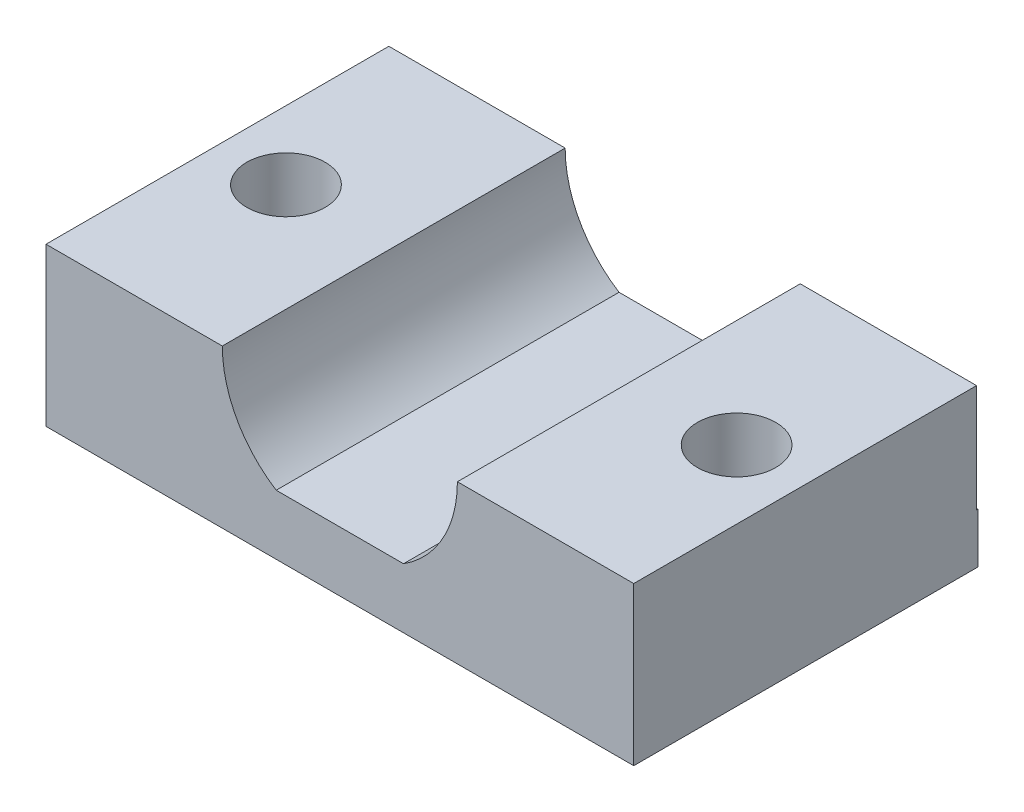
from build123d import *

# Parameters (mm, degrees)
SKETCH_2_W               = 50
SKETCH_2_H               = 4
EXTRUDE_2_DEPTH          = 22.5
SKETCH_15_R              = 1.4
EXTRUDE_8_DEPTH          = 5
SKETCH_3_W               = 30
SKETCH_3_H               = 20
EXTRUDE_4_DEPTH          = 20
EXTRUDE_9_DEPTH          = 17.5
EXTRUDE_10_DEPTH         = 15
CUT_EXTRUDE_1_REACH      = 58.089
SKETCH_19_R              = 2.1
SKETCH_20_R              = 2
CUT_EXTRUDE_2_DEPTH      = 10
CUT_EXTRUDE_3_DEPTH      = 70.524879929
CUT_EXTRUDE_3_DEPTH_BACK = 70.524879929


with BuildPart() as part:
    # 草圖2 → 填料-伸長2 (new, symmetric)
    with BuildSketch(Plane(origin=(0, 0, 0), x_dir=(0, 0, -1), z_dir=(1, 0, 0))):
        with Locations((25, 2)):
            Rectangle(SKETCH_2_W, SKETCH_2_H)
    extrude(amount=EXTRUDE_2_DEPTH, both=True)

    # 草圖15 → 填料-伸長8 (add)
    with BuildSketch(Plane(origin=(0, 4, 0), x_dir=(1, 0, 0), z_dir=(0, 1, 0))):
        with Locations(Location((17.5, 39.2, 0), (0, 0, 90))):
            Circle(SKETCH_15_R)
        with Locations(Location((17.5, 24.2, 0), (0, 0, 90))):
            Circle(SKETCH_15_R)
    extrude(amount=EXTRUDE_8_DEPTH)

    # 草圖3 → 填料-伸長4 (add)
    with BuildSketch(Plane(origin=(0, 4, 0), x_dir=(1, 0, 0), z_dir=(0, 1, 0))):
        with Locations((0, 10)):
            Rectangle(SKETCH_3_W, SKETCH_3_H)
    extrude(amount=EXTRUDE_4_DEPTH)

    # 草圖16 → 填料-伸長9 (add)
    with BuildSketch(Plane(origin=(0, 0, 0), x_dir=(-1, 0, 0), z_dir=(0, 0, -1))):
        with BuildLine():
            Line((-15, 24), (-15, 36.000002525))
            Line((-15, 36.000002525), (-6, 36.000002525))
            ThreePointArc((-6, 36.000002525), (-5.267141914, 33.146824473), (-3.25, 31.000002525))
            Line((-3.25, 31.000002525), (3.25, 31.000002525))
            ThreePointArc((3.25, 31.000002525), (5.267141914, 33.146824473), (6, 36.000002525))
            Line((6, 36.000002525), (15, 36.000002525))
            Line((15, 36.000002525), (15, 24))
            Line((15, 24), (-15, 24))
        make_face()
    extrude(amount=EXTRUDE_9_DEPTH)

    # 草圖18 → 填料-伸長10 (add, symmetric)
    with BuildSketch(Plane(origin=(0, 0, 0), x_dir=(0, 0, -1), z_dir=(1, 0, 0))):
        Polygon((17.5, 24), (28.5, 24), (28.5, 42.748788628), (27, 42.748788628), (27, 30.5), (17.5, 30.5), align=None)
    extrude(amount=EXTRUDE_10_DEPTH, both=True)

    # 草圖19 → 除料-伸長1 (cut, up to next)
    with BuildSketch(Plane(origin=(0, 0, -28.5), x_dir=(-1, 0, 0), z_dir=(0, 0, -1)), mode=Mode.PRIVATE) as cut_extrude_1_sk1:
        with Locations((0, 36.000002505)):
            Circle(SKETCH_19_R)
    cut_extrude_1_tool1 = extrude(cut_extrude_1_sk1.sketch, amount=-CUT_EXTRUDE_1_REACH, mode=Mode.PRIVATE) & part.part
    add(cut_extrude_1_tool1.solids().sort_by_distance((0, 36.000003, -28.5))[0], mode=Mode.SUBTRACT)

    # 草圖20 → 除料-伸長2 (cut)
    with BuildSketch(Plane(origin=(0, 36.000002525, 0), x_dir=(1, 0, 0), z_dir=(0, 1, 0))):
        with Locations(Location((-11.5, 8.75, 0), (0, 0, 180))):
            Circle(SKETCH_20_R)
        with Locations(Location((11.5, 8.75, 0), (0, 0, 180))):
            Circle(SKETCH_20_R)
    extrude(amount=-CUT_EXTRUDE_2_DEPTH, mode=Mode.SUBTRACT)

    # 草圖21 → 除料-伸長3 (cut, two sides: drawn at the far end of the back side and taken through both)
    with BuildSketch(Plane(origin=(0, 0, 0), x_dir=(0, 0, -1), z_dir=(1, 0, 0)).offset(-CUT_EXTRUDE_3_DEPTH_BACK)):
        Polygon((0, 0), (0, 27.945687573), (17.572849685, 27.945687573), (17.572849685, 46.39939524), (61.461395387, 46.39939524), (61.461395387, 0), align=None)
    extrude(amount=CUT_EXTRUDE_3_DEPTH + CUT_EXTRUDE_3_DEPTH_BACK, mode=Mode.SUBTRACT)


solid = part.part
